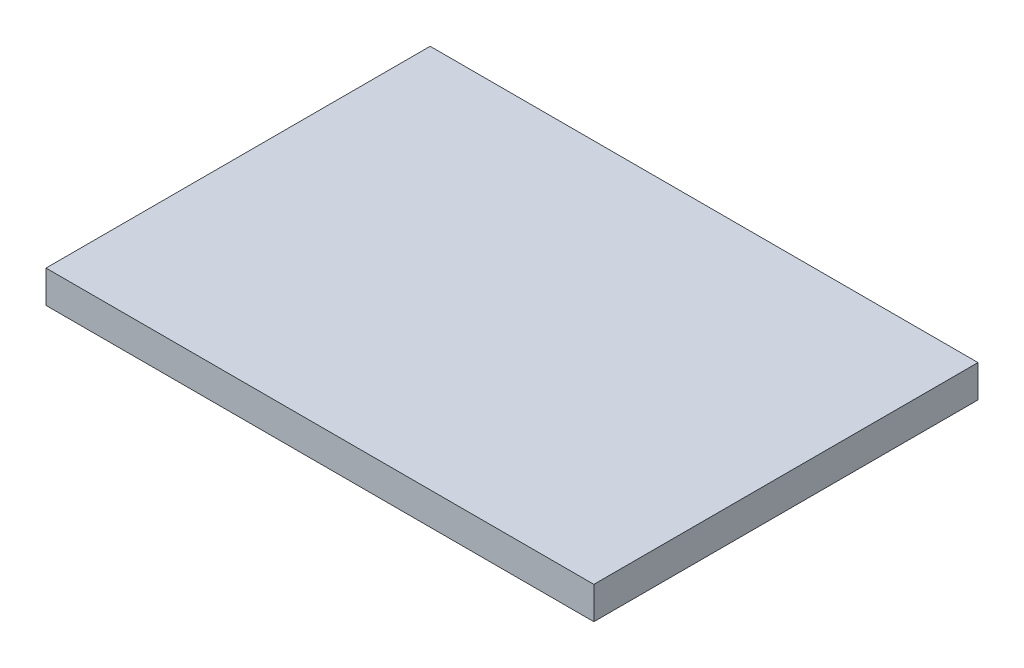
from build123d import *

# Parameters (mm, degrees)
BOSS_EXTRUDE1_DEPTH = 226


with BuildPart() as part:
    # Sketch1 → Boss-Extrude1 (new body)
    with BuildSketch(Plane.XY):
        Polygon((161.15, -14.05), (161.15, -33.1), (-161.15, -33.1), (-161.15, -14.05), (-100.131670195, -14.05), (100.131670195, -14.05), align=None)
    extrude(amount=BOSS_EXTRUDE1_DEPTH)


solid = part.part
